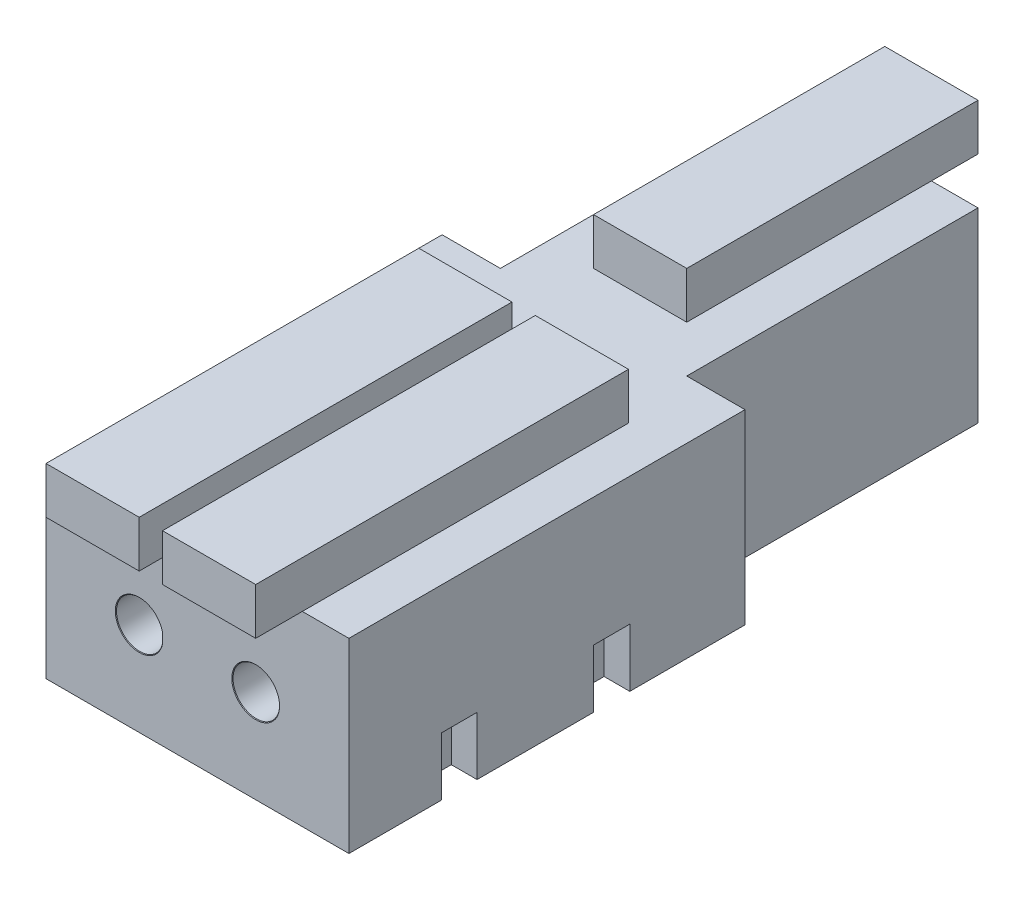
from build123d import *

# Parameters (mm, degrees)
SKETCH1_W                  = 8
SKETCH1_H                  = 17
CONNECTOR_BODY_DEPTH       = 8
SKETCH4_W                  = 4
SKETCH4_H                  = 16
CLAMP_DEPTH                = 2
CONNECTOR_PATTERN_COUNT    = 2
CONNECTOR_PATTERN_PITCH    = 5
SKETCH5_W                  = 8
SKETCH5_H                  = 12.5
SINGLE_BODY_DEPTH          = 8
SKETCH6_W                  = 1.5
SKETCH6_H                  = 2.500390225
CHAINING_NOBS_DEPTH        = 1
SKETCH7_W                  = 1.10359402
SKETCH7_H                  = 1.518729337
SKETCH7_H_2                = 1.556223895
CHAINING_NOBS_CUTOUT_DEPTH = 2.5
SKETCH8_W                  = 4
SKETCH8_H                  = 12.5
SINGLE_BODY_CLAMP_DEPTH    = 2


with BuildPart() as part:
    # Sketch1 → connector_body (new body)
    with BuildSketch(Plane(origin=(0, 0, 0), x_dir=(1, 0, 0), z_dir=(0, 1, 0))):
        with Locations((4, 8.5)):
            Rectangle(SKETCH1_W, SKETCH1_H)
    connector_body = extrude(amount=CONNECTOR_BODY_DEPTH)

    # Sketch3 → cable_hole (revolve, cut)
    with BuildSketch(Plane(origin=(4, 4, 0), x_dir=(0, -1, 0), z_dir=(1, 0, 0))):
        Polygon((0, 0), (0, 10.600860619), (1, 10), (1, 0.025), (1.025, 0), align=None)
    cable_hole = revolve(axis=Axis((4, 4, 6.35), (0, 0, -1)), mode=Mode.SUBTRACT)

    # Sketch4 → clamp (add)
    with BuildSketch(Plane(origin=(0, 8, 0), x_dir=(1, 0, 0), z_dir=(0, 1, 0))):
        with Locations((4, 6)):
            Rectangle(SKETCH4_W, SKETCH4_H)
    clamp = extrude(amount=CLAMP_DEPTH)

    # connector_pattern: connector_body, cable_hole, clamp ×2
    with Locations(*[(i * CONNECTOR_PATTERN_PITCH, 0, 0) for i in range(1, CONNECTOR_PATTERN_COUNT)]):
        add(connector_body)
        add(cable_hole, mode=Mode.SUBTRACT)
        add(clamp)

    # Sketch5 → single_body (add)
    with BuildSketch(Plane(origin=(0, 8, 0), x_dir=(1, 0, 0), z_dir=(0, 1, 0))):
        with Locations((6.5, 23.25)):
            Rectangle(SKETCH5_W, SKETCH5_H)
    extrude(amount=-SINGLE_BODY_DEPTH)

    # Sketch6 → chaining_nobs (add)
    with BuildSketch(Plane.ZY):
        with Locations((-11.25, 1.250195113)):
            Rectangle(SKETCH6_W, SKETCH6_H)
        with Locations((-4.75, 1.250195113)):
            Rectangle(SKETCH6_W, SKETCH6_H)
    extrude(amount=CHAINING_NOBS_DEPTH)

    # Sketch7 → chaining_nobs_cutout (cut)
    with BuildSketch(Plane.XZ):
        with Locations((12.44820299, -4.740635332)):
            Rectangle(SKETCH7_W, SKETCH7_H)
        with Locations((12.44820299, -11.278111948)):
            Rectangle(SKETCH7_W, SKETCH7_H_2)
    extrude(amount=-CHAINING_NOBS_CUTOUT_DEPTH, mode=Mode.SUBTRACT)

    # Sketch8 → single_body_clamp (add)
    with BuildSketch(Plane(origin=(0, 8, 0), x_dir=(1, 0, 0), z_dir=(0, 1, 0))):
        with Locations((6.5, 25.25)):
            Rectangle(SKETCH8_W, SKETCH8_H)
    extrude(amount=SINGLE_BODY_CLAMP_DEPTH)


solid = part.part
